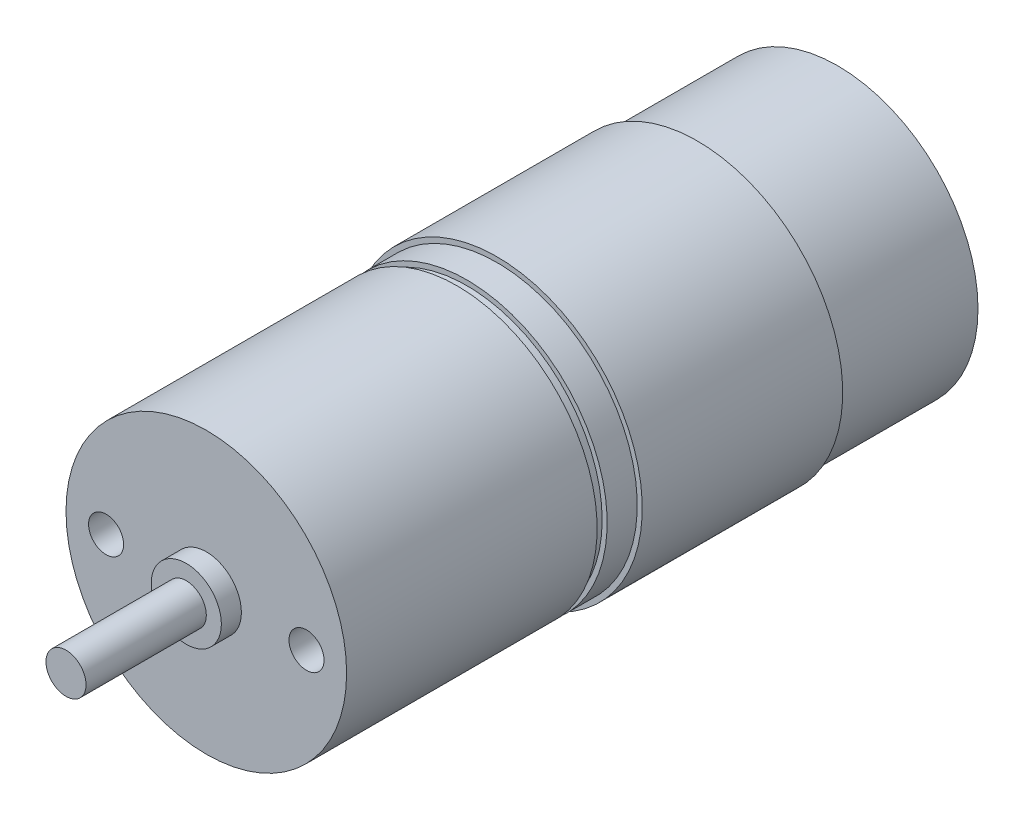
from build123d import *

# Parameters (mm, degrees)
SKETCH1_R           = 14
BOSS_EXTRUDE1_DEPTH = 63
SKETCH2_R           = 3.5
BOSS_EXTRUDE2_DEPTH = 2
SKETCH3_R           = 2
BOSS_EXTRUDE3_DEPTH = 12
SKETCH4_R           = 14.5
BOSS_EXTRUDE4_DEPTH = 20
SKETCH5_OUTSIDE_W   = 48.448
SKETCH5_OUTSIDE_H   = 48.448
SKETCH5_OUTSIDE_R   = 13.5
CUT_EXTRUDE1_DEPTH  = 1
SKETCH6_R           = 1.75
CUT_EXTRUDE2_DEPTH  = 10


with BuildPart() as part:
    # Sketch1 → Boss-Extrude1 (new body)
    with BuildSketch(Plane.XY):
        Circle(SKETCH1_R)
    extrude(amount=BOSS_EXTRUDE1_DEPTH)

    # Sketch2 → Boss-Extrude2 (add)
    with BuildSketch(Plane.XY.offset(63)):
        Circle(SKETCH2_R)
    extrude(amount=BOSS_EXTRUDE2_DEPTH)

    # Sketch3 → Boss-Extrude3 (add)
    with BuildSketch(Plane.XY.offset(65)):
        Circle(SKETCH3_R)
    extrude(amount=BOSS_EXTRUDE3_DEPTH)

    # Sketch4 → Boss-Extrude4 (add)
    with BuildSketch(Plane(origin=(0, 0, 14), x_dir=(-1, 0, 0), z_dir=(0, 0, -1))):
        Circle(SKETCH4_R)
    extrude(amount=-BOSS_EXTRUDE4_DEPTH)

    # Sketch5 outside → Cut-Extrude1 (cut)
    with BuildSketch(Plane(origin=(0, 0, 37), x_dir=(-1, 0, 0), z_dir=(0, 0, -1))):
        Rectangle(SKETCH5_OUTSIDE_W, SKETCH5_OUTSIDE_H)
        Circle(SKETCH5_OUTSIDE_R, mode=Mode.SUBTRACT)
    extrude(amount=-CUT_EXTRUDE1_DEPTH, mode=Mode.SUBTRACT)

    # Sketch6 → Cut-Extrude2 (cut)
    with BuildSketch(Plane.XY.offset(63)):
        with Locations((-10, 0)):
            Circle(SKETCH6_R)
        with Locations((10, 0)):
            Circle(SKETCH6_R)
    extrude(amount=-CUT_EXTRUDE2_DEPTH, mode=Mode.SUBTRACT)


solid = part.part
